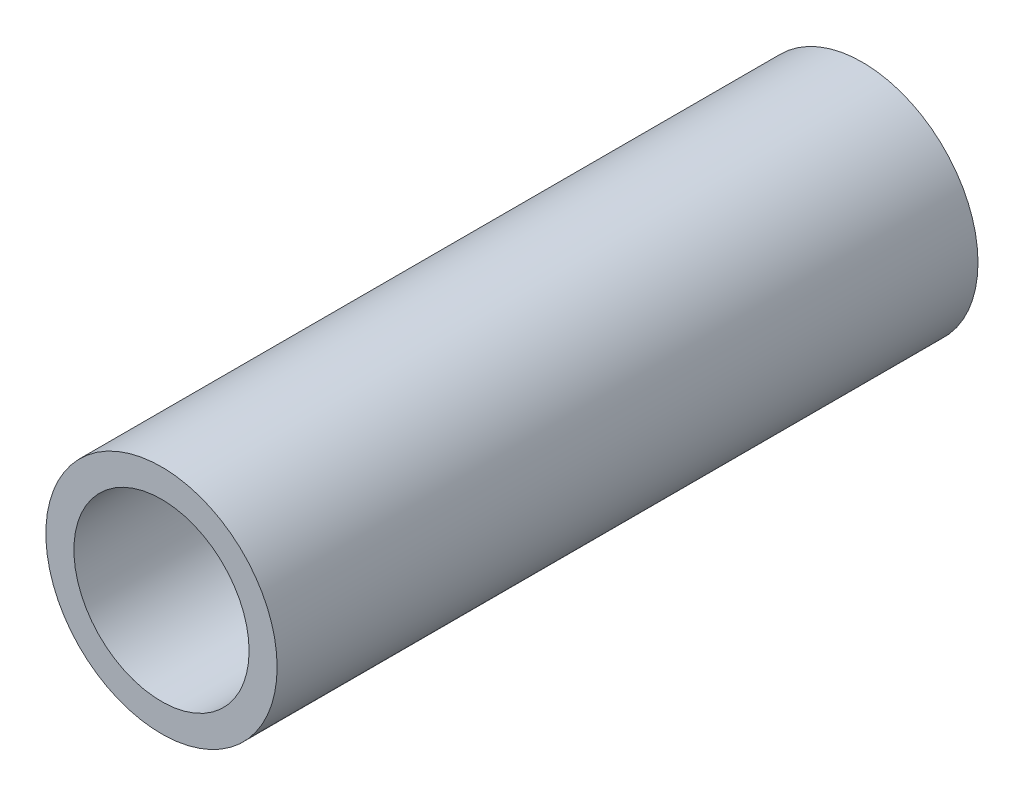
from build123d import *

# Parameters (mm, degrees)
SKETCH_1_R      = 16.5
SKETCH_1_R_2    = 12.5
EXTRUDE_1_DEPTH = 100


with BuildPart() as part:
    # 草图1 → 凸台-拉伸1 (new body)
    with BuildSketch(Plane.XY):
        Circle(SKETCH_1_R)
        Circle(SKETCH_1_R_2, mode=Mode.SUBTRACT)
    extrude(amount=EXTRUDE_1_DEPTH)


solid = part.part
